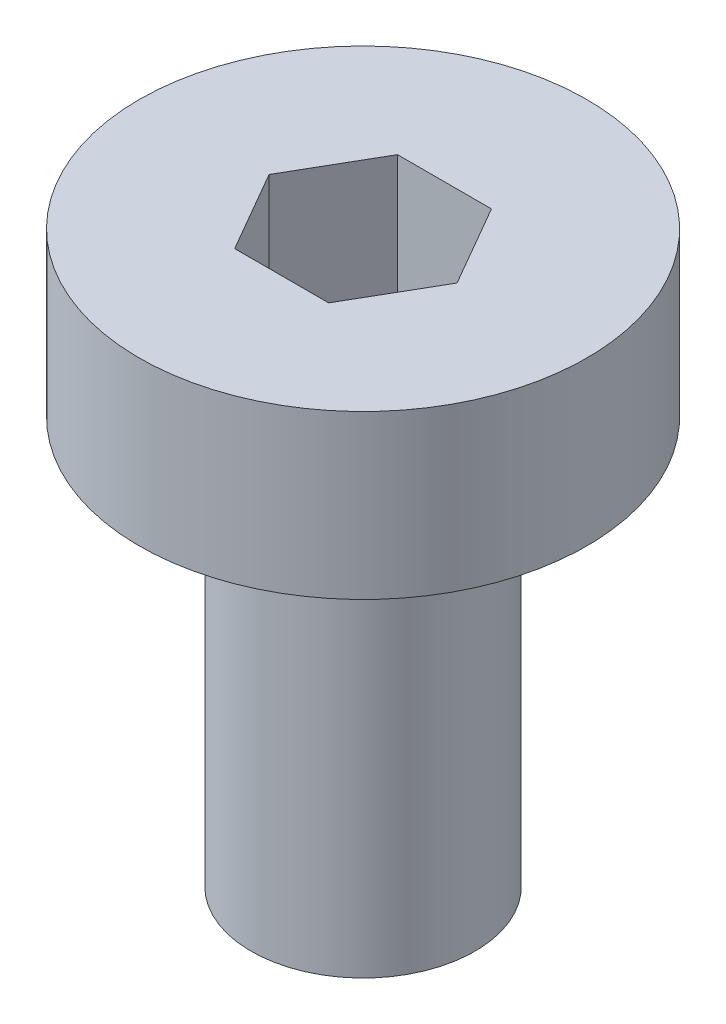
from build123d import *

# Parameters (mm, degrees)
CUT_EXTRUDE1_DEPTH = 1.5


with BuildPart() as part:
    # Sketch1 → Revolve1 (revolve)
    with BuildSketch(Plane.XY):
        Polygon((0, 2), (-2.75, 2), (-2.75, 0), (-1.375, 0), (-1.375, -5), (0, -5), align=None)
    revolve(axis=Axis((0, -5, 0), (0, -1, 0)))

    # Sketch2 → Cut-Extrude1 (cut)
    with BuildSketch(Plane(origin=(0, 2, 0), x_dir=(1, 0, 0), z_dir=(0, 1, 0))):
        Polygon((0.577350269, -1), (1.154700538, 0), (0.577350269, 1), (-0.577350269, 1), (-1.154700538, 0), (-0.577350269, -1), align=None)
    extrude(amount=-CUT_EXTRUDE1_DEPTH, mode=Mode.SUBTRACT)


solid = part.part
